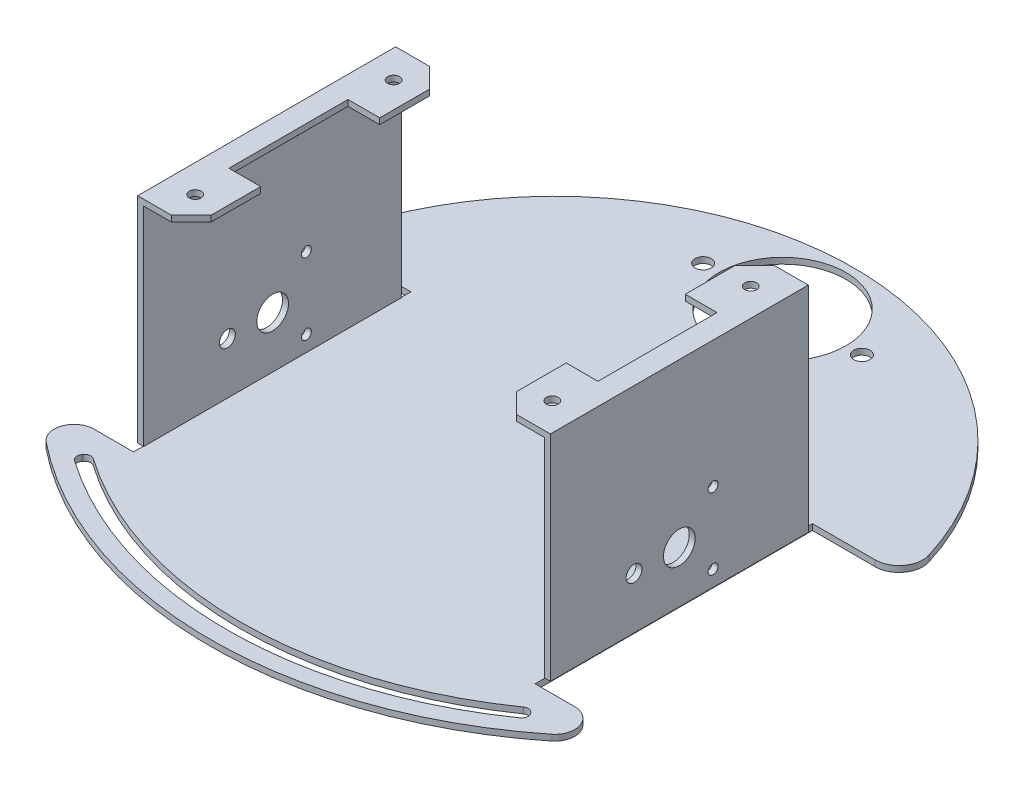
from build123d import *

# Parameters (mm, degrees)
SKETCH_1_R               = 16
EXTRUDE_1_DEPTH          = 1.5
EXTRUDE_START            = 1.5
EXTRUDE_2_DEPTH          = 53.5
CUT_EXTRUDE_1_DEPTH      = 54
CUT_EXTRUDE_1_DEPTH_BACK = 133.235118037
SKETCH_5_R               = 4
EXTRUDE_START_2          = 55.5
EXTRUDE_3_DEPTH          = 1.5
CUT_EXTRUDE_START        = 50
SKETCH_9_R               = 1.5
CUT_EXTRUDE_2_DEPTH      = 83.443861474
SKETCH_11_R              = 2.05
CUT_EXTRUDE_3_DEPTH      = 132.822329073
CHAMFER_1_SIZE           = 5
CUT_EXTRUDE_4_DEPTH      = 133.443861474
CUT_EXTRUDE_4_DEPTH_BACK = 133.443861474
SKETCH_12_R              = 2
SKETCH_12_R_2            = 1.25
CUT_EXTRUDE_5_DEPTH      = 10
FILLET_1_R               = 1.6


with BuildPart() as part:
    # Эскиз1 → Бобышка-Вытянуть1 (new body)
    # profile 1 of 3: a face of its own
    with BuildSketch(Plane(origin=(0, 0, 0), x_dir=(1, 0, 0), z_dir=(0, 1, 0))):
        with BuildLine():
            Line((-50.6, 34.95), (-50.6, 0))
            Line((-50.6, 0), (-50.6, -34.95))
            Line((-50.6, -34.95), (-56.797799253, -34.95))
            Line((-56.797799253, -34.95), (-60.588262065, -34.95))
            ThreePointArc((-60.588262065, -34.95), (-65.306481849, -38.29518821), (-63.711368357, -43.854639175))
            ThreePointArc((-63.711368357, -43.854639175), (0, -66.2), (63.711368357, -43.854639175))
            ThreePointArc((63.711368357, -43.854639175), (65.306481849, -38.29518821), (60.588262065, -34.95))
            Line((60.588262065, -34.95), (50.6, -34.95))
            Line((50.6, -34.95), (50.6, 0))
            Line((50.6, 0), (50.6, 34.95))
            Line((50.6, 34.95), (66.052990091, 34.95))
            Line((66.052990091, 34.95), (66.314478057, 34.95))
            Line((66.314478057, 34.95), (66.423245178, 34.95))
            ThreePointArc((66.423245178, 34.95), (71.249879914, 37.385789411), (72.157626057, 42.715467626))
            ThreePointArc((72.157626057, 42.715467626), (0, 96), (-72.157626057, 42.715467626))
            ThreePointArc((-72.157626057, 42.715467626), (-71.249879914, 37.385789411), (-66.423245178, 34.95))
            Line((-66.423245178, 34.95), (-50.6, 34.95))
        make_face()
        with Locations(Location((0, 78, 0), (0, 0, 270))):
            Circle(SKETCH_1_R, mode=Mode.SUBTRACT)
    # profile 2 of 3: a face of its own
    with BuildSketch(Plane(origin=(0, 0, 0), x_dir=(1, 0, 0), z_dir=(0, 1, 0))):
        with BuildLine():
            Line((-50.6, 34.95), (-50.6, 0))
            Line((-50.6, 0), (-50.6, -34.95))
            Line((-50.6, -34.95), (-56.797799253, -34.95))
            Line((-56.797799253, -34.95), (-60.588262065, -34.95))
            ThreePointArc((-60.588262065, -34.95), (-65.306481849, -38.29518821), (-63.711368357, -43.854639175))
            ThreePointArc((-63.711368357, -43.854639175), (0, -66.2), (63.711368357, -43.854639175))
            ThreePointArc((63.711368357, -43.854639175), (65.306481849, -38.29518821), (60.588262065, -34.95))
            Line((60.588262065, -34.95), (50.6, -34.95))
            Line((50.6, -34.95), (50.6, 0))
            Line((50.6, 0), (50.6, 34.95))
            Line((50.6, 34.95), (66.052990091, 34.95))
            Line((66.052990091, 34.95), (66.314478057, 34.95))
            Line((66.314478057, 34.95), (66.423245178, 34.95))
            ThreePointArc((66.423245178, 34.95), (71.249879914, 37.385789411), (72.157626057, 42.715467626))
            ThreePointArc((72.157626057, 42.715467626), (0, 96), (-72.157626057, 42.715467626))
            ThreePointArc((-72.157626057, 42.715467626), (-71.249879914, 37.385789411), (-66.423245178, 34.95))
            Line((-66.423245178, 34.95), (-50.6, 34.95))
        make_face()
        with Locations(Location((0, 78, 0), (0, 0, 270))):
            Circle(SKETCH_1_R, mode=Mode.SUBTRACT)
    # profile 3 of 3: a face of its own
    with BuildSketch(Plane(origin=(0, 0, 0), x_dir=(1, 0, 0), z_dir=(0, 1, 0))):
        with BuildLine():
            Line((-50.6, 34.95), (-50.6, 0))
            Line((-50.6, 0), (-50.6, -34.95))
            Line((-50.6, -34.95), (-56.797799253, -34.95))
            Line((-56.797799253, -34.95), (-60.588262065, -34.95))
            ThreePointArc((-60.588262065, -34.95), (-65.306481849, -38.29518821), (-63.711368357, -43.854639175))
            ThreePointArc((-63.711368357, -43.854639175), (0, -66.2), (63.711368357, -43.854639175))
            ThreePointArc((63.711368357, -43.854639175), (65.306481849, -38.29518821), (60.588262065, -34.95))
            Line((60.588262065, -34.95), (50.6, -34.95))
            Line((50.6, -34.95), (50.6, 0))
            Line((50.6, 0), (50.6, 34.95))
            Line((50.6, 34.95), (66.052990091, 34.95))
            Line((66.052990091, 34.95), (66.314478057, 34.95))
            Line((66.314478057, 34.95), (66.423245178, 34.95))
            ThreePointArc((66.423245178, 34.95), (71.249879914, 37.385789411), (72.157626057, 42.715467626))
            ThreePointArc((72.157626057, 42.715467626), (0, 96), (-72.157626057, 42.715467626))
            ThreePointArc((-72.157626057, 42.715467626), (-71.249879914, 37.385789411), (-66.423245178, 34.95))
            Line((-66.423245178, 34.95), (-50.6, 34.95))
        make_face()
        with Locations(Location((0, 78, 0), (0, 0, 270))):
            Circle(SKETCH_1_R, mode=Mode.SUBTRACT)
    extrude(amount=EXTRUDE_1_DEPTH)

    # Эскиз3 → Бобышка-Вытянуть2 (add)
    with BuildSketch(Plane(origin=(0, 0, 0), x_dir=(1, 0, 0), z_dir=(0, 1, 0)).offset(EXTRUDE_START)):
        Polygon((-52, 0), (-52, 32.5), (-50.5, 32.5), (-50.5, -32.5), (-52, -32.5), align=None)
        Polygon((52, -32.5), (52, 0), (52, 32.5), (50.5, 32.5), (50.5, -32.5), align=None)
    extrude(amount=EXTRUDE_2_DEPTH)

    # Эскиз5 → Вырез-Вытянуть1 (cut, two sides: drawn at the far end of the back side and taken through both)
    with BuildSketch(Plane(origin=(0, 0, 0), x_dir=(0, 0, -1), z_dir=(1, 0, 0)).offset(-CUT_EXTRUDE_1_DEPTH_BACK)):
        with Locations(Location((0, 14.5, 0), (0, 0, 180))):
            Circle(SKETCH_5_R)
    extrude(amount=CUT_EXTRUDE_1_DEPTH + CUT_EXTRUDE_1_DEPTH_BACK, mode=Mode.SUBTRACT)

    # Эскиз6 → Бобышка-Вытянуть3 (add)
    with BuildSketch(Plane(origin=(0, 0, 0), x_dir=(1, 0, 0), z_dir=(0, 1, 0)).offset(EXTRUDE_START_2)):
        Polygon((-52, 32.5), (-52, 0), (-52, -32.5), (-38.5, -32.5), (-38.5, -15), (-46.5, -15), (-46.5, 0), (-46.5, 15), (-38.5, 15), (-38.5, 32.5), align=None)
        Polygon((46.5, 0), (46.5, -15), (38.5, -15), (38.5, -32.5), (52, -32.5), (52, 0), (52, 32.5), (38.5, 32.5), (38.5, 15), (46.5, 15), align=None)
    extrude(amount=-EXTRUDE_3_DEPTH)

    # Эскиз9 → Вырез-Вытянуть2 (cut, through all)
    with BuildSketch(Plane(origin=(0, 0, 0), x_dir=(1, 0, 0), z_dir=(0, 1, 0)).offset(CUT_EXTRUDE_START)):
        with Locations(Location((-45, 25, 0), (0, 0, 270))):
            Circle(SKETCH_9_R)
        with Locations(Location((-45, -25, 0), (0, 0, 90))):
            Circle(SKETCH_9_R)
        with Locations(Location((45, -25, 0), (0, 0, 270))):
            Circle(SKETCH_9_R)
        with Locations(Location((45, 25, 0), (0, 0, 90))):
            Circle(SKETCH_9_R)
    extrude(amount=CUT_EXTRUDE_2_DEPTH, mode=Mode.SUBTRACT)

    # Эскиз11 → Вырез-Вытянуть3 (cut, through all)
    with BuildSketch(Plane(origin=(0, 1.5, 0), x_dir=(1, 0, 0), z_dir=(0, 1, 0))):
        with Locations(Location((20, 78, 0), (0, 0, 270))):
            Circle(SKETCH_11_R)
        with Locations(Location((-20, 78, 0), (0, 0, 270))):
            Circle(SKETCH_11_R)
    extrude(amount=-CUT_EXTRUDE_3_DEPTH, mode=Mode.SUBTRACT)

    # Фаска1
    chamfer_1_edges = [part.edges().sort_by_distance(p)[0] for p in [
        (38.5, 54.75, -32.5),
        (38.5, 54.75, 32.5),
        (-38.5, 54.75, 32.5),
        (-38.5, 54.75, -32.5),
    ]]
    chamfer(chamfer_1_edges, length=CHAMFER_1_SIZE)

    # Эскиз12 → Вырез-Вытянуть4 (cut, two sides: drawn at the far end of the back side and taken through both)
    with BuildSketch(Plane(origin=(0, 0, 0), x_dir=(0, 0, -1), z_dir=(1, 0, 0)).offset(-CUT_EXTRUDE_4_DEPTH_BACK)):
        with Locations((-11.4, 14.5)):
            Circle(SKETCH_12_R)
        with Locations((8.5, 23.5)):
            Circle(SKETCH_12_R_2)
        with Locations((8.5, 5.5)):
            Circle(SKETCH_12_R_2)
    extrude(amount=CUT_EXTRUDE_4_DEPTH + CUT_EXTRUDE_4_DEPTH_BACK, mode=Mode.SUBTRACT)

    # Эскиз13 → Вырез-Вытянуть5 (cut)
    with BuildSketch(Plane(origin=(0, 1.5, 0), x_dir=(1, 0, 0), z_dir=(0, 1, 0))):
        with BuildLine():
            Line((0, -62), (0, -58.6))
            ThreePointArc((0, -58.6), (-29.171204269, -53.979735138), (-55.486927816, -40.571204269))
            Line((-55.486927816, -40.571204269), (-57.485397674, -43.32186205))
            ThreePointArc((-57.485397674, -43.32186205), (-30.22186205, -57.213327294), (0, -62))
        make_face()
        with BuildLine():
            ThreePointArc((55.486927816, -40.571204269), (29.171204269, -53.979735138), (0, -58.6))
            Line((0, -58.6), (0, -62))
            ThreePointArc((0, -62), (30.22186205, -57.213327294), (57.485397674, -43.32186205))
            Line((57.485397674, -43.32186205), (55.486927816, -40.571204269))
        make_face()
    extrude(amount=-CUT_EXTRUDE_5_DEPTH, mode=Mode.SUBTRACT)

    # Скругление1
    fillet_1_edges = [part.edges().sort_by_distance(p)[0] for p in [
        (-55.486927816, 0.75, 40.571204269),
        (55.486927816, 0.75, 40.571204269),
        (57.485397674, 0.75, 43.32186205),
        (-57.485397674, 0.75, 43.32186205),
    ]]
    fillet(fillet_1_edges, radius=FILLET_1_R)


solid = part.part
